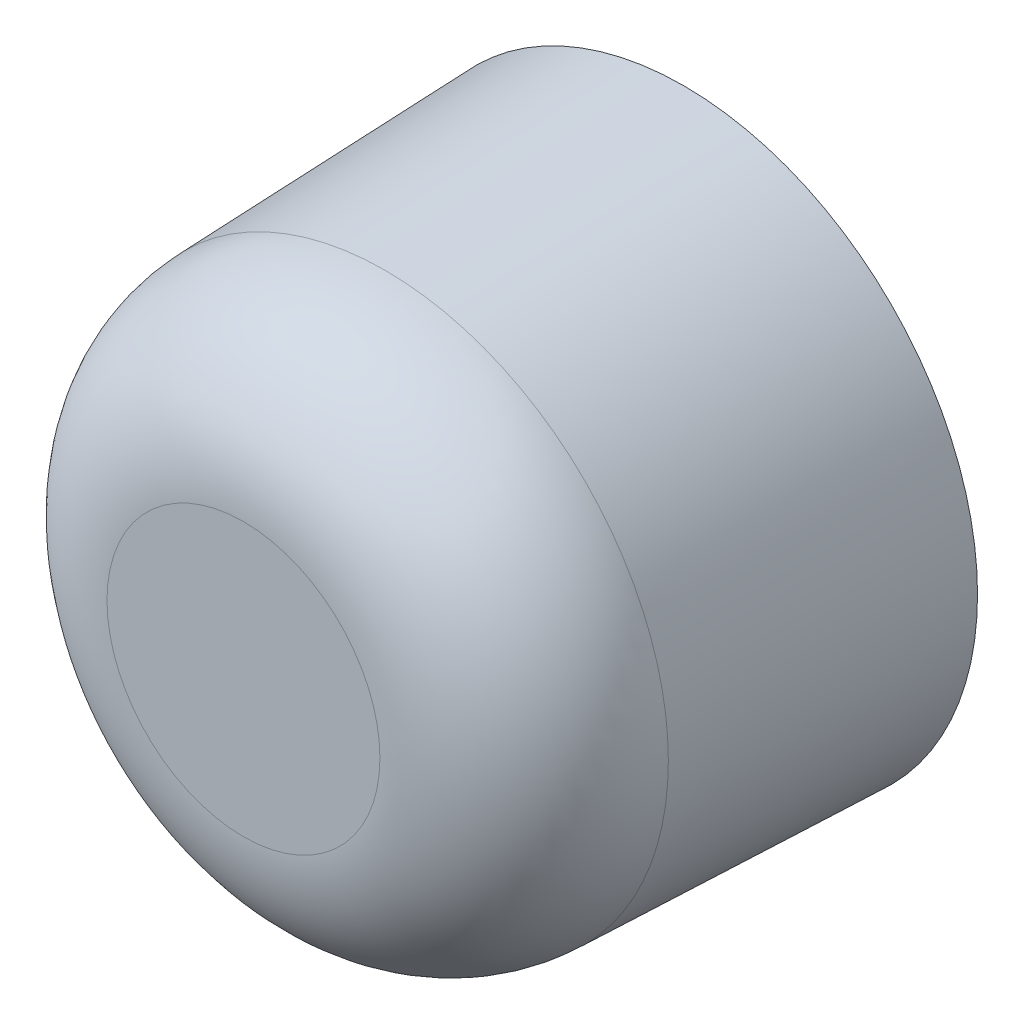
from build123d import *

# Parameters (mm, degrees)
ESQUISSE1_R             = 10
BOSS_EXTRU_1_DEPTH      = 15
BOSS_EXTRU_1_TAPER      = 2
CONG_1_R                = 5
ESQUISSE2_R             = 3
ENL_V_MAT_EXTRU_1_DEPTH = 12
ESQUISSE3_R             = 7.5
ENL_V_MAT_EXTRU_2_DEPTH = 5


with BuildPart() as part:
    # Esquisse1 → Boss.-Extru.1 (new body)
    with BuildSketch(Plane.XY):
        Circle(ESQUISSE1_R)
    extrude(amount=BOSS_EXTRU_1_DEPTH, taper=BOSS_EXTRU_1_TAPER)

    # Congé1
    cong_1_edges = [part.edges().sort_by_distance(p)[0] for p in [
        (-9.476188458, 0, 15),
    ]]
    fillet(cong_1_edges, radius=CONG_1_R)

    # Esquisse2 → Enlèv. mat.-Extru.1 (cut)
    with BuildSketch(Plane(origin=(0, 0, 0), x_dir=(-1, 0, 0), z_dir=(0, 0, -1))):
        Circle(ESQUISSE2_R)
    extrude(amount=-ENL_V_MAT_EXTRU_1_DEPTH, mode=Mode.SUBTRACT)

    # Esquisse3 → Enlèv. mat.-Extru.2 (cut)
    with BuildSketch(Plane(origin=(0, 0, 0), x_dir=(-1, 0, 0), z_dir=(0, 0, -1))):
        Circle(ESQUISSE3_R)
    extrude(amount=-ENL_V_MAT_EXTRU_2_DEPTH, mode=Mode.SUBTRACT)


solid = part.part
